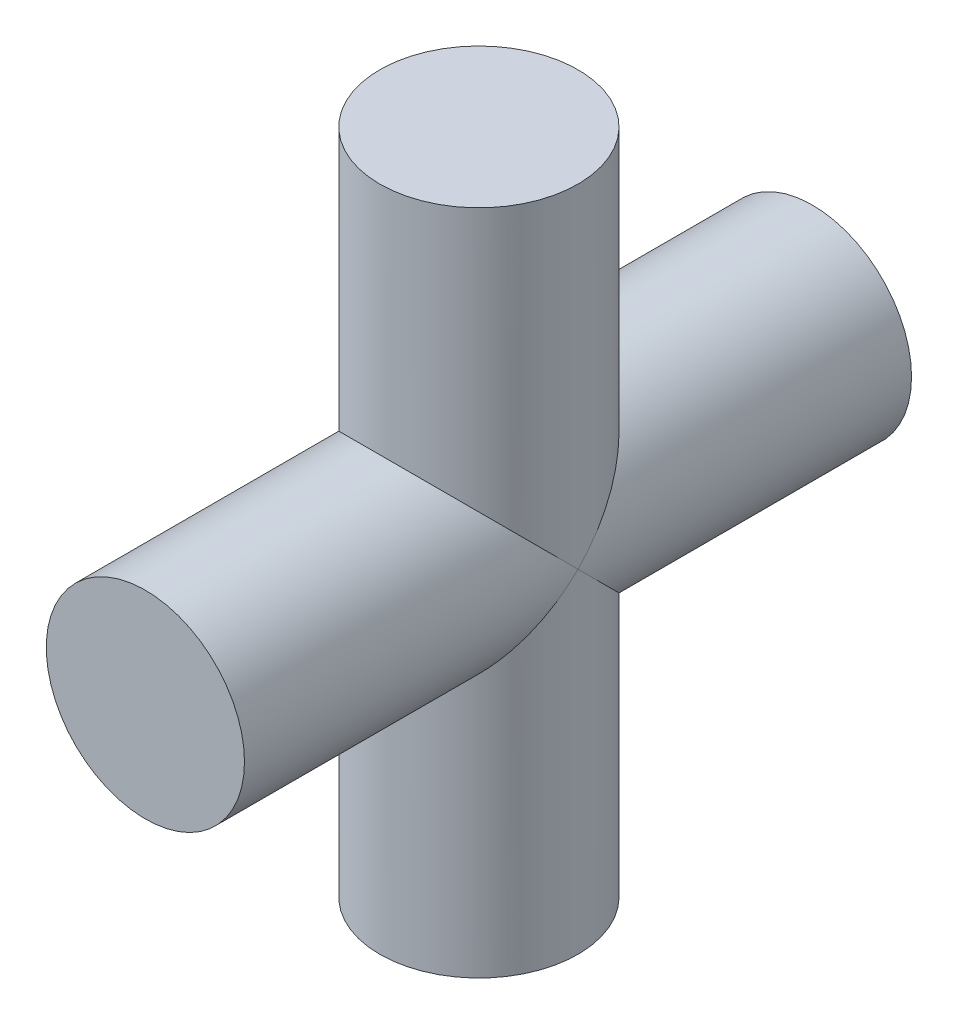
from build123d import *

# Parameters (mm, degrees)
BOSS_EXTRUDE1_DEPTH      = 26.924
BOSS_EXTRUDE1_DEPTH_BACK = 26.924
SKETCH1_R                = 8
BOSS_EXTRUDE2_DEPTH      = 26.924
BOSS_EXTRUDE2_DEPTH_BACK = 26.924
SKETCH2_R                = 8


with BuildPart() as part:
    # Sketch1 → Boss-Extrude1 (new, two sides: drawn at the far end of the back side and taken through both)
    with BuildSketch(Plane(origin=(0, 0, 0), x_dir=(1, 0, 0), z_dir=(0, 1, 0)).offset(-BOSS_EXTRUDE1_DEPTH_BACK)):
        Circle(SKETCH1_R)
    extrude(amount=BOSS_EXTRUDE1_DEPTH + BOSS_EXTRUDE1_DEPTH_BACK)

    # Sketch2 → Boss-Extrude2 (add, two sides: drawn at the far end of the back side and taken through both)
    with BuildSketch(Plane.XY.offset(-BOSS_EXTRUDE2_DEPTH_BACK)):
        Circle(SKETCH2_R)
    extrude(amount=BOSS_EXTRUDE2_DEPTH + BOSS_EXTRUDE2_DEPTH_BACK)


solid = part.part
